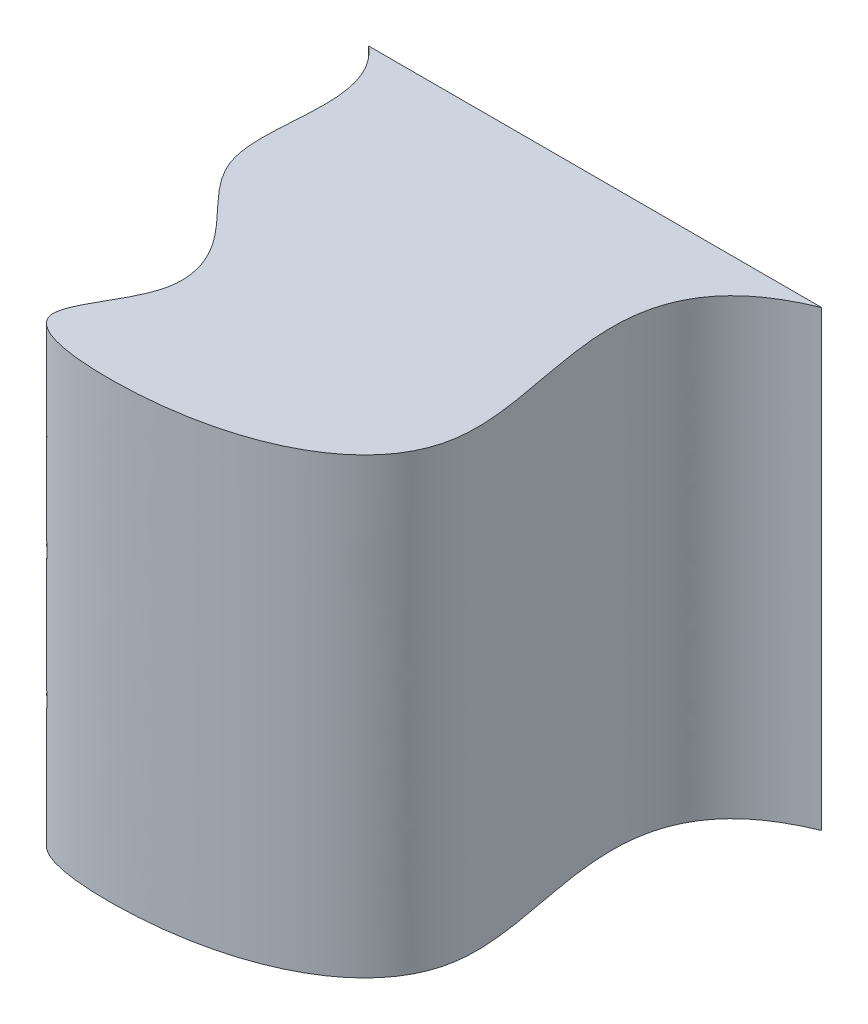
from build123d import *

# Parameters (mm, degrees)
SKETCH1_W           = 300
SKETCH1_H           = 300
BOSS_EXTRUDE2_DEPTH = 300
CUT_EXTRUDE2_DEPTH  = 300


with BuildPart() as part:
    # Sketch1 → Boss-Extrude2 (new body)
    with BuildSketch(Plane.XY):
        with Locations((150, 150)):
            Rectangle(SKETCH1_W, SKETCH1_H)
    extrude(amount=BOSS_EXTRUDE2_DEPTH)

    # Sketch3 → Cut-Extrude2 (cut)
    with BuildSketch(Plane(origin=(0, 300, 0), x_dir=(1, 0, 0), z_dir=(0, 1, 0))):
        with BuildLine():
            Line((0, 0), (0, -300))
            Line((0, -300), (300, -300))
            Line((300, -300), (300, 0))
            add(Edge.make_bspline(
                [(0, 0), (35.16502817, -29.652333263), (-8.357662947, -109.625530646), (63.875924944, -155.994391091), (80.131602579, -212.407682337), (23.793909591, -271.005941294), (158.683216248, -285.515087254), (321.467545976, -212.455352802), (194.601714239, -42.983502708), (300, 0)],
                knots=[0, 0, 0, 0, 0.161035142, 0.258683402, 0.309274165, 0.391817284, 0.481288934, 0.701541446, 1, 1, 1, 1], degree=3))
        make_face()
    extrude(amount=-CUT_EXTRUDE2_DEPTH, mode=Mode.SUBTRACT)


solid = part.part
